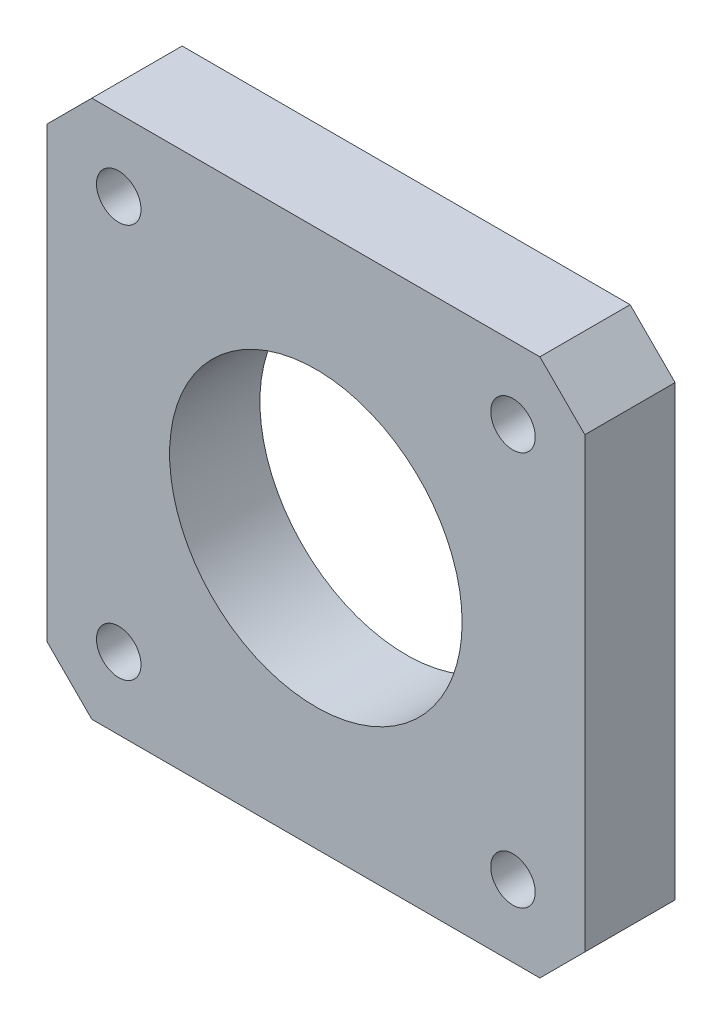
from build123d import *

# Parameters (mm, degrees)
SKETCH1_R           = 1.75
SKETCH1_R_2         = 11.5
BOSS_EXTRUDE1_DEPTH = 3.55


with BuildPart() as part:
    # Sketch1 → Boss-Extrude1 (new, symmetric)
    with BuildSketch(Plane.XY):
        Polygon((21.15, -17.614466094), (21.15, 17.614466094), (17.614466094, 21.15), (-17.614466094, 21.15), (-21.15, 17.614466094), (-21.15, -17.614466094), (-17.614466094, -21.15), (17.614466094, -21.15), align=None)
        with Locations((-15.5, 15.5)):
            Circle(SKETCH1_R, mode=Mode.SUBTRACT)
        with Locations((15.5, 15.5)):
            Circle(SKETCH1_R, mode=Mode.SUBTRACT)
        with Locations((15.5, -15.5)):
            Circle(SKETCH1_R, mode=Mode.SUBTRACT)
        with Locations((-15.5, -15.5)):
            Circle(SKETCH1_R, mode=Mode.SUBTRACT)
        Circle(SKETCH1_R_2, mode=Mode.SUBTRACT)
    extrude(amount=BOSS_EXTRUDE1_DEPTH, both=True)


solid = part.part
